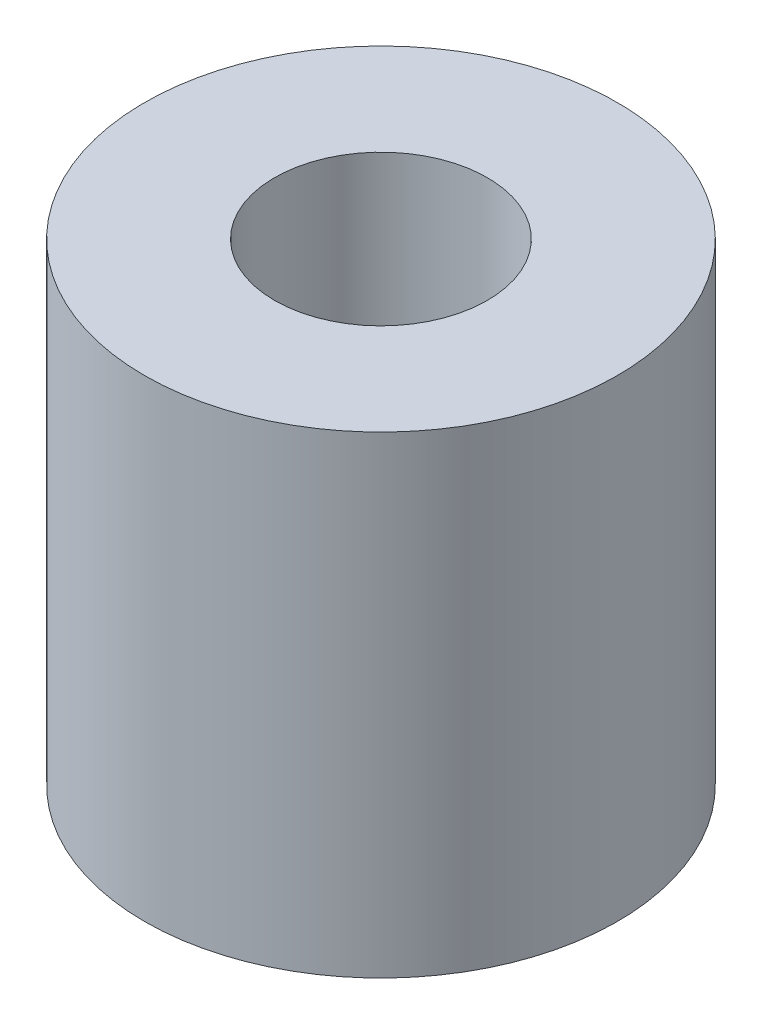
from build123d import *

# Parameters (mm, degrees)
SKETCH1_R           = 10
SKETCH1_R_2         = 4.5
BOSS_EXTRUDE1_DEPTH = 20
SKETCH2_R           = 1
CUT_EXTRUDE1_DEPTH  = 2


with BuildPart() as part:
    # Sketch1 → Boss-Extrude1 (new body)
    with BuildSketch(Plane(origin=(0, 0, 0), x_dir=(1, 0, 0), z_dir=(0, 1, 0))):
        with Locations(Location((0, 0, 0), (0, 0, 270))):
            Circle(SKETCH1_R)
        with Locations(Location((0, 0, 0), (0, 0, 270))):
            Circle(SKETCH1_R_2, mode=Mode.SUBTRACT)
    extrude(amount=BOSS_EXTRUDE1_DEPTH)

    # Sketch2 → Cut-Extrude1 (cut)
    with BuildSketch(Plane.XZ):
        with Locations(Location((-7.25, 0, 0), (0, 0, 270))):
            Circle(SKETCH2_R)
        with Locations(Location((-6.532024292, 3.145657109, 0), (0, 0, 270))):
            Circle(SKETCH2_R)
        with Locations(Location((-4.520301063, 5.668278248, 0), (0, 0, 270))):
            Circle(SKETCH2_R)
        with Locations(Location((-1.613276771, 7.068227363, 0), (0, 0, 270))):
            Circle(SKETCH2_R)
        with Locations(Location((1.613276771, 7.068227363, 0), (0, 0, 270))):
            Circle(SKETCH2_R)
        with Locations(Location((4.520301063, 5.668278248, 0), (0, 0, 270))):
            Circle(SKETCH2_R)
        with Locations(Location((6.532024292, 3.145657109, 0), (0, 0, 270))):
            Circle(SKETCH2_R)
        with Locations(Location((7.25, 0, 0), (0, 0, 270))):
            Circle(SKETCH2_R)
        with Locations(Location((6.532024292, -3.145657109, 0), (0, 0, 270))):
            Circle(SKETCH2_R)
        with Locations(Location((4.520301063, -5.668278248, 0), (0, 0, 270))):
            Circle(SKETCH2_R)
        with Locations(Location((1.613276771, -7.068227363, 0), (0, 0, 270))):
            Circle(SKETCH2_R)
        with Locations(Location((-1.613276771, -7.068227363, 0), (0, 0, 270))):
            Circle(SKETCH2_R)
        with Locations(Location((-4.520301063, -5.668278248, 0), (0, 0, 270))):
            Circle(SKETCH2_R)
        with Locations(Location((-6.532024292, -3.145657109, 0), (0, 0, 270))):
            Circle(SKETCH2_R)
    extrude(amount=-CUT_EXTRUDE1_DEPTH, mode=Mode.SUBTRACT)


solid = part.part
